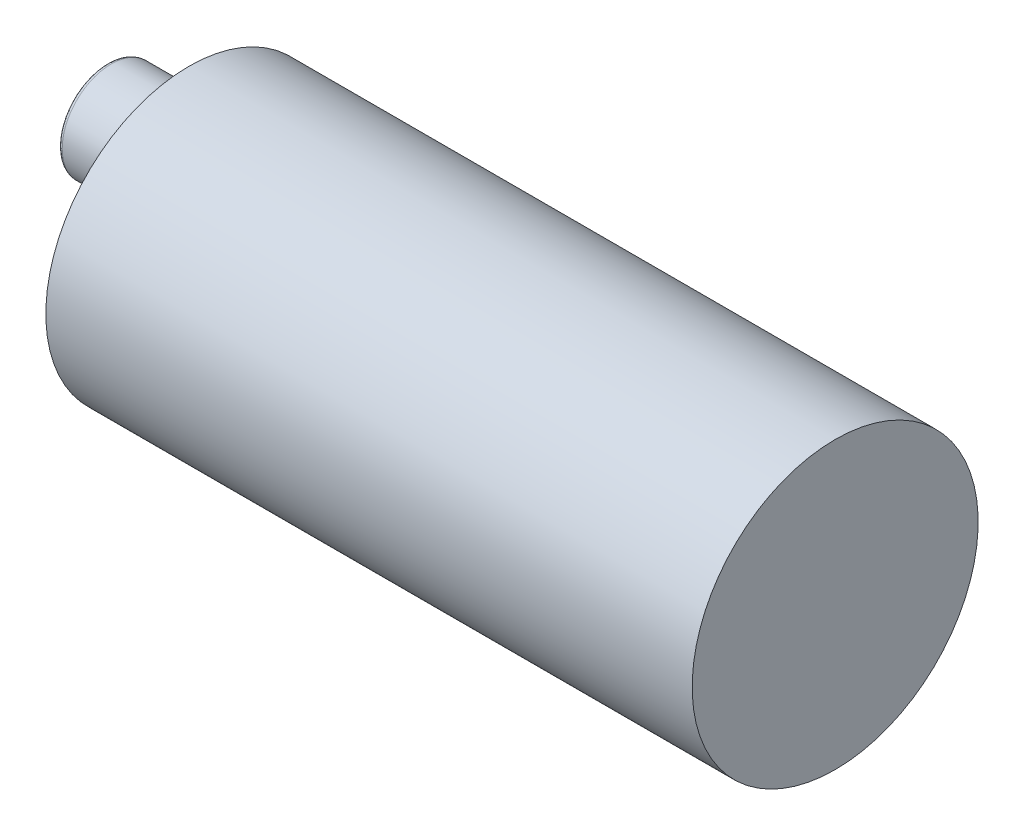
from build123d import *

# Parameters (mm, degrees)
SKETCH1_W           = 79.1
SKETCH1_H           = 17.5
SKETCH2_R           = 6
BOSS_EXTRUDE1_DEPTH = 10
FILLET2_R           = 0.5
SKETCH3_R           = 3
CUT_EXTRUDE3_DEPTH  = 3


with BuildPart() as part:
    # Sketch1 → Revolve1 (revolve)
    with BuildSketch(Plane.XY):
        with Locations((-13.391352503, -1.567164179)):
            Rectangle(SKETCH1_W, SKETCH1_H)
    revolve(axis=Axis((-52.941352503, 7.182835821, 0), (1, 0, 0)))

    # Sketch2 → Boss-Extrude1 (add)
    with BuildSketch(Plane.ZY.offset(52.941352503)):
        with Locations((0, 14.182835821)):
            Circle(SKETCH2_R)
    extrude(amount=BOSS_EXTRUDE1_DEPTH)

    # Fillet2
    fillet2_edges = [part.edges().sort_by_distance(p)[0] for p in [
        (-62.941352503, 14.182835821, -6),
    ]]
    fillet(fillet2_edges, radius=FILLET2_R)

    # Sketch3 → Cut-Extrude3 (cut)
    with BuildSketch(Plane.ZY.offset(62.941352503)):
        with Locations((0, 14.182835821)):
            Circle(SKETCH3_R)
    extrude(amount=-CUT_EXTRUDE3_DEPTH, mode=Mode.SUBTRACT)


solid = part.part
